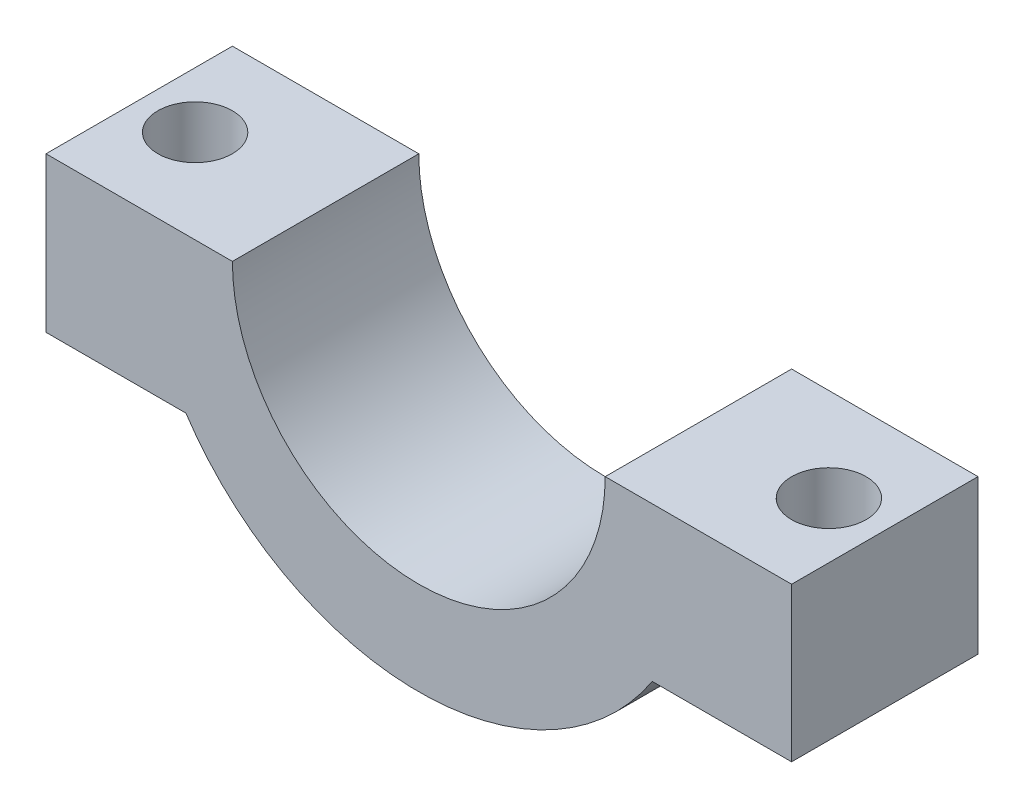
from build123d import *

# Parameters (mm, degrees)
BOSS_EXTRUDE1_DEPTH = 10


with BuildPart() as part:
    # Sketch1 → Boss-Extrude1 (new body)
    with BuildSketch(Plane.XY):
        with BuildLine():
            Line((-15, 0), (-10, 0))
            ThreePointArc((-10, 0), (0, -10), (10, 0))
            Line((10, 0), (15, 0))
            Line((15, 0), (20, 0))
            Line((20, 0), (20, -8.252048805))
            Line((20, -8.252048805), (12.52612033, -8.252048805))
            ThreePointArc((12.52612033, -8.252048805), (10.716124589, -10.495936061), (8.510293561, -12.352121417))
            ThreePointArc((8.510293561, -12.352121417), (0, -15), (-8.510293561, -12.352121417))
            ThreePointArc((-8.510293561, -12.352121417), (-10.697242908, -10.515179227), (-12.496376594, -8.297021877))
            Line((-12.496376594, -8.297021877), (-20, -8.297021877))
            Line((-20, -8.297021877), (-20, 0))
            Line((-20, 0), (-15, 0))
        make_face()
    extrude(amount=BOSS_EXTRUDE1_DEPTH)

    # Sketch7 → Ø4.0 (4) Diameter Hole2 (revolve, cut)
    with BuildSketch(Plane(origin=(17, 0, 5), x_dir=(0, 0, 1), z_dir=(1, 0, 0))):
        Polygon((0, 0), (0, 11.201721238), (2, 10), (2, 0), align=None)
    f_4_0_4_diameter_hole2 = revolve(axis=Axis((17, 6.35, 5), (0, -1, 0)), mode=Mode.SUBTRACT)

    # Mirror2: Ø4.0 (4) Diameter Hole2 across plane
    add(f_4_0_4_diameter_hole2.mirror(Plane(origin=(0, 0, 0), x_dir=(0, 0, 1), z_dir=(1, 0, 0))), mode=Mode.SUBTRACT)


solid = part.part
